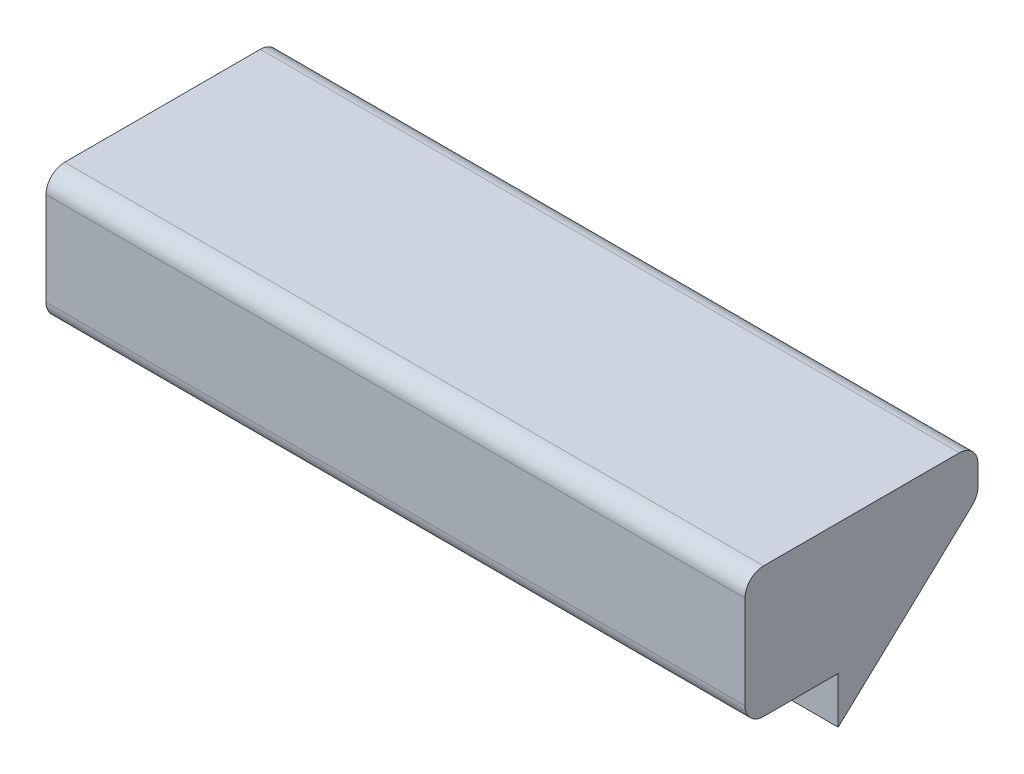
from build123d import *

# Parameters (mm, degrees)
EXTRUDE_1_DEPTH = 75
FILLET_1_R      = 2


with BuildPart() as part:
    # ｽｹｯﾁ1 → ﾎﾞｽ - 押し出し1 (new body)
    with BuildSketch(Plane(origin=(0, 0, 0), x_dir=(0, 0, -1), z_dir=(1, 0, 0))):
        Polygon((0, 0), (0, -14), (10, -14), (10, -19), (25, -5), (25, 0), align=None)
    extrude(amount=EXTRUDE_1_DEPTH)

    # ﾌｨﾚｯﾄ1
    fillet_1_edges = [part.edges().sort_by_distance(p)[0] for p in [
        (37.5, 0, -25),
        (37.5, -5, -25),
        (37.5, -14, 0),
        (37.5, 0, 0),
    ]]
    fillet(fillet_1_edges, radius=FILLET_1_R)


solid = part.part
